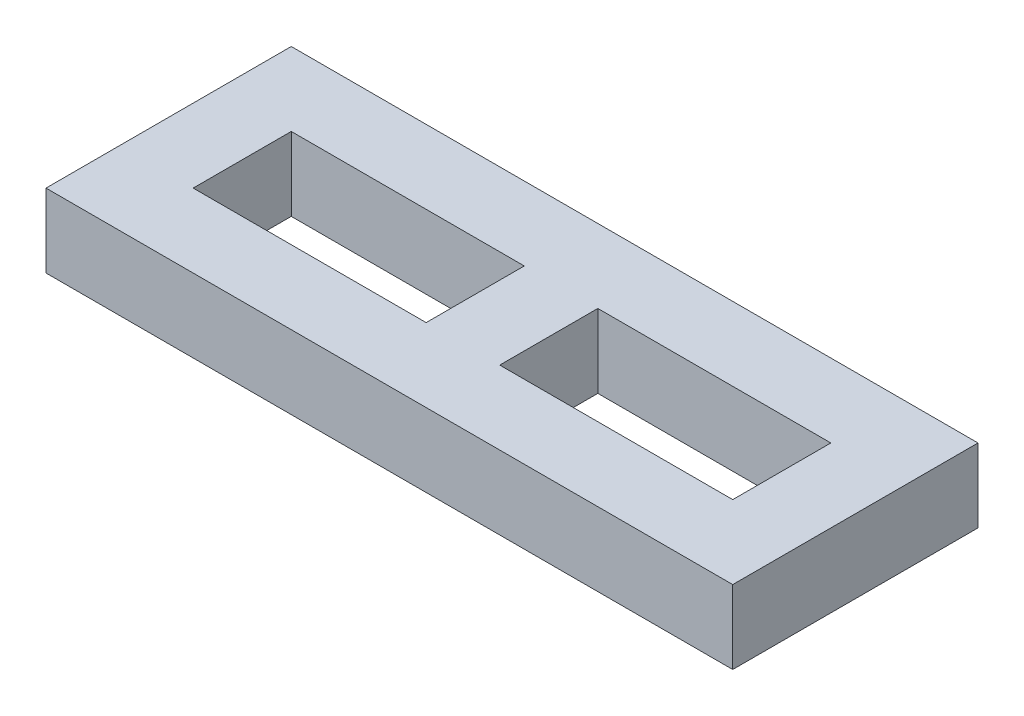
from build123d import *

# Parameters (mm, degrees)
SKETCH1_W           = 63.5
SKETCH1_H           = 19.05
BOSS_EXTRUDE1_DEPTH = 88.9
SKETCH5_W           = 60.325
SKETCH5_H           = 25.4
CUT_EXTRUDE4_DEPTH  = 97.302518139


with BuildPart() as part:
    # Sketch1 → Boss-Extrude1 (new, symmetric)
    with BuildSketch(Plane(origin=(0, 0, 0), x_dir=(0, 0, -1), z_dir=(1, 0, 0))):
        Rectangle(SKETCH1_W, SKETCH1_H)
    extrude(amount=BOSS_EXTRUDE1_DEPTH, both=True)

    # Sketch5 → Cut-Extrude4 (cut, through all)
    with BuildSketch(Plane(origin=(0, 9.525, 0), x_dir=(1, 0, 0), z_dir=(0, 1, 0))):
        with Locations((-39.6875, 0)):
            Rectangle(SKETCH5_W, SKETCH5_H)
        with Locations((39.6875, 0)):
            Rectangle(SKETCH5_W, SKETCH5_H)
    extrude(amount=-CUT_EXTRUDE4_DEPTH, mode=Mode.SUBTRACT)


solid = part.part
